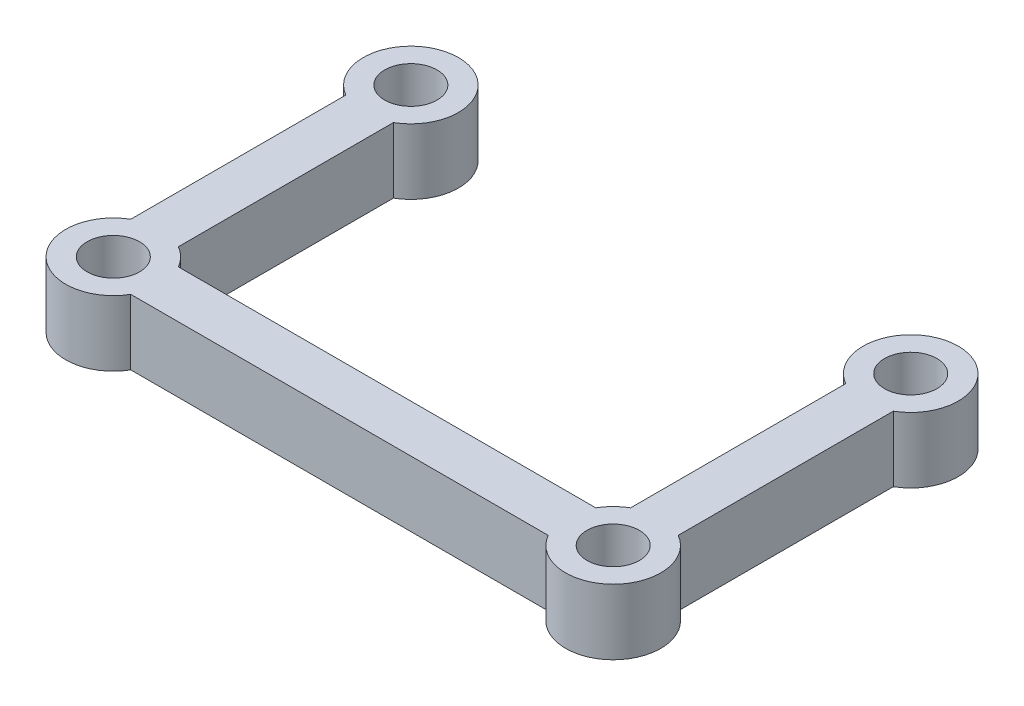
from build123d import *

# Parameters (mm, degrees)
EXTUDEMAIN_DEPTH = 2.75
PIHOLES_REACH    = 29.328
SKETCH2_R        = 1.1


with BuildPart() as part:
    # Main → ExtudeMain (new body)
    with BuildSketch(Plane(origin=(0, 0, 0), x_dir=(1, 0, 0), z_dir=(0, 1, 0))):
        with BuildLine():
            Line((-19.267949192, 1), (-1.732050808, 1))
            ThreePointArc((-1.732050808, 1), (-1.414213562, 1.414213562), (-1, 1.732050808))
            Line((-1, 1.732050808), (-1, 10.767949192))
            ThreePointArc((-1, 10.767949192), (0, 14.5), (1, 10.767949192))
            Line((1, 10.767949192), (1, 1.732050808))
            ThreePointArc((1, 1.732050808), (1.414213562, -1.414213562), (-1.732050808, -1))
            Line((-1.732050808, -1), (-19.267949192, -1))
            ThreePointArc((-19.267949192, -1), (-22.414213562, -1.414213562), (-22, 1.732050808))
            Line((-22, 1.732050808), (-22, 10.767949192))
            ThreePointArc((-22, 10.767949192), (-21, 14.5), (-20, 10.767949192))
            Line((-20, 10.767949192), (-20, 1.732050808))
            ThreePointArc((-20, 1.732050808), (-19.585786438, 1.414213562), (-19.267949192, 1))
        make_face()
    extrude(amount=EXTUDEMAIN_DEPTH)

    # Sketch2 → PiHoles (cut, up to next)
    with BuildSketch(Plane(origin=(0, 2.75, 0), x_dir=(1, 0, 0), z_dir=(0, 1, 0)), mode=Mode.PRIVATE) as piholes_sk1:
        with Locations(Location((-21, 12.5, 0), (0, 0, 270))):
            Circle(SKETCH2_R)
    piholes_tool1 = extrude(piholes_sk1.sketch, amount=-PIHOLES_REACH, mode=Mode.PRIVATE) & part.part
    # Sketch2 → PiHoles (cut, up to next)
    with BuildSketch(Plane(origin=(0, 2.75, 0), x_dir=(1, 0, 0), z_dir=(0, 1, 0)), mode=Mode.PRIVATE) as piholes_sk2:
        with Locations(Location((0, 12.5, 0), (0, 0, 270))):
            Circle(SKETCH2_R)
    piholes_tool2 = extrude(piholes_sk2.sketch, amount=-PIHOLES_REACH, mode=Mode.PRIVATE) & part.part
    # Sketch2 → PiHoles (cut, up to next)
    with BuildSketch(Plane(origin=(0, 2.75, 0), x_dir=(1, 0, 0), z_dir=(0, 1, 0)), mode=Mode.PRIVATE) as piholes_sk3:
        with Locations(Location((0, 0, 0), (0, 0, 270))):
            Circle(SKETCH2_R)
    piholes_tool3 = extrude(piholes_sk3.sketch, amount=-PIHOLES_REACH, mode=Mode.PRIVATE) & part.part
    # Sketch2 → PiHoles (cut, up to next)
    with BuildSketch(Plane(origin=(0, 2.75, 0), x_dir=(1, 0, 0), z_dir=(0, 1, 0)), mode=Mode.PRIVATE) as piholes_sk4:
        with Locations(Location((-21, 0, 0), (0, 0, 270))):
            Circle(SKETCH2_R)
    piholes_tool4 = extrude(piholes_sk4.sketch, amount=-PIHOLES_REACH, mode=Mode.PRIVATE) & part.part
    add(piholes_tool1.solids().sort_by_distance((-21, 2.75, -12.5))[0], mode=Mode.SUBTRACT)
    add(piholes_tool2.solids().sort_by_distance((0, 2.75, -12.5))[0], mode=Mode.SUBTRACT)
    add(piholes_tool3.solids().sort_by_distance((0, 2.75, 0))[0], mode=Mode.SUBTRACT)
    add(piholes_tool4.solids().sort_by_distance((-21, 2.75, 0))[0], mode=Mode.SUBTRACT)


solid = part.part
